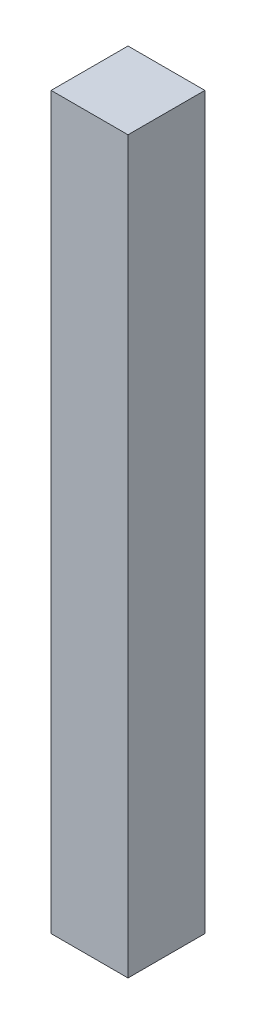
from build123d import *

# Parameters (mm, degrees)
SKETCH_1_W      = 20
SKETCH_1_H      = 20
EXTRUDE_1_DEPTH = 95


with BuildPart() as part:
    # Эскиз1 → Бобышка-Вытянуть1 (new, symmetric)
    with BuildSketch(Plane(origin=(0, 0, 0), x_dir=(1, 0, 0), z_dir=(0, 1, 0))):
        Rectangle(SKETCH_1_W, SKETCH_1_H)
    extrude(amount=EXTRUDE_1_DEPTH, both=True)


solid = part.part
